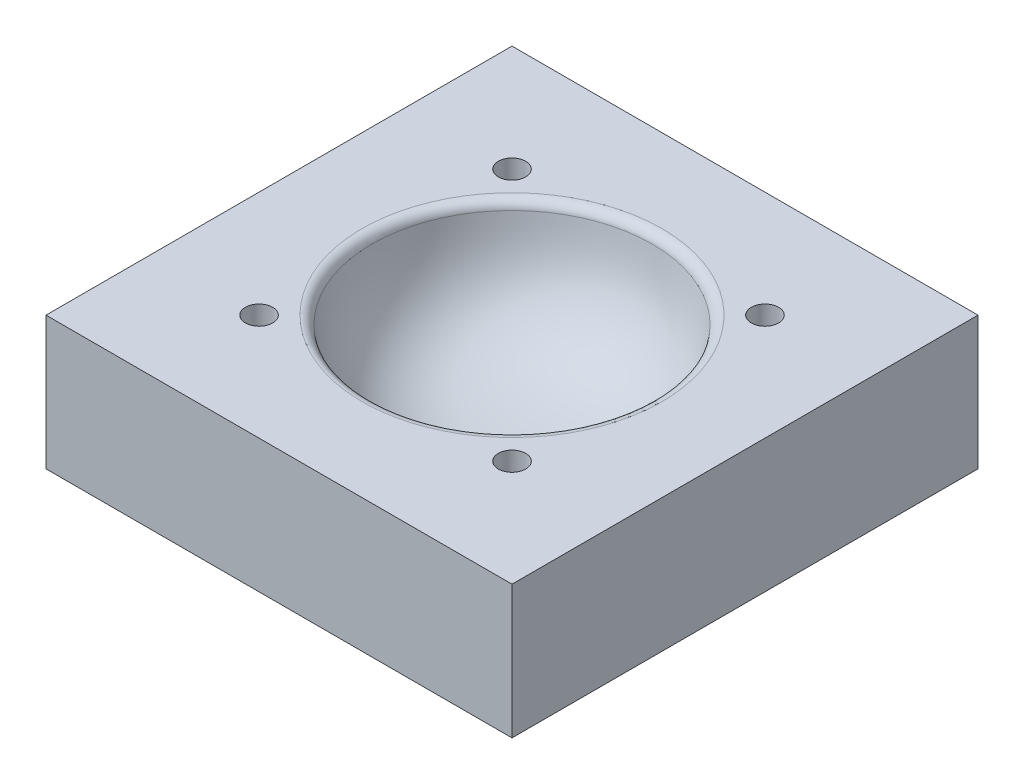
from build123d import *

# Parameters (mm, degrees)
SKETCH2_W           = 70
SKETCH2_H           = 70
BOSS_EXTRUDE1_DEPTH = 20
FILLET1_R           = 1.5
SKETCH3_R           = 2.05
CUT_EXTRUDE1_DEPTH  = 54.385391391


with BuildPart() as part:
    # Sketch2 → Boss-Extrude1 (new body)
    with BuildSketch(Plane(origin=(0, 0, 0), x_dir=(1, 0, 0), z_dir=(0, 1, 0))):
        Rectangle(SKETCH2_W, SKETCH2_H)
    extrude(amount=-BOSS_EXTRUDE1_DEPTH)

    # Sketch1 → Cut-Revolve1 (revolve, cut)
    with BuildSketch(Plane.XY, mode=Mode.PRIVATE) as cut_revolve1_sk:
        with BuildLine():
            Line((0, -17.2), (0, 0))
            Line((0, 0), (21.241684944, 0))
            Line((21.241684944, 0), (21.158851084, -0.511526958))
            add(Edge.make_bspline(
                [(0, -17.2), (0.530678283, -17.2), (1.61157482, -17.183508716), (3.615531125, -17.08588663), (5.944127269, -16.844919371), (8.44843367, -16.370131279), (11.442656399, -15.492934033), (14.579654851, -13.93724298), (17.382164488, -11.402739011), (19.199009229, -8.500896664), (20.23569058, -5.583194157), (20.706490619, -3.313387562), (20.981886079, -1.635929169), (21.096876841, -0.894238762), (21.158851084, -0.511526958)],
                knots=[0, 0, 0, 0, 0.03125, 0.0625, 0.125, 0.1875, 0.25, 0.375, 0.5, 0.625, 0.75, 0.875, 0.9375, 1, 1, 1, 1], degree=3))
        make_face()
    revolve(cut_revolve1_sk.sketch.rotate(Axis((0, -17.2, 0), (0, 1, 0)), 90), axis=Axis((0, -17.2, 0), (0, 1, 0)), mode=Mode.SUBTRACT)

    # Fillet1
    fillet1_edges = [part.edges().sort_by_distance(p)[0] for p in [
        (0, 0, 21.241684944),
    ]]
    fillet(fillet1_edges, radius=FILLET1_R)

    # Sketch3 → Cut-Extrude1 (cut, through all)
    with BuildSketch(Plane(origin=(0, 0, 0), x_dir=(1, 0, 0), z_dir=(0, 1, 0))):
        with Locations(Location((-19, 19, 0), (0, 0, 270))):
            Circle(SKETCH3_R)
        with Locations(Location((19, -19, 0), (0, 0, 90))):
            Circle(SKETCH3_R)
        with Locations(Location((-19, -19, 0), (0, 0, 90))):
            Circle(SKETCH3_R)
        with Locations(Location((19, 19, 0), (0, 0, 270))):
            Circle(SKETCH3_R)
    extrude(amount=-CUT_EXTRUDE1_DEPTH, mode=Mode.SUBTRACT)


solid = part.part
